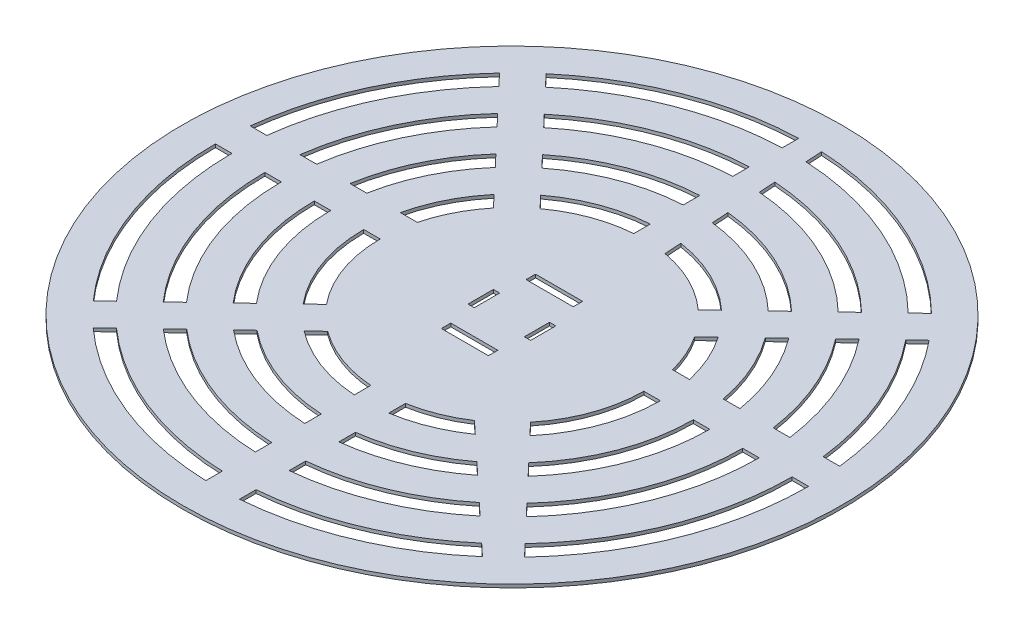
from build123d import *

# Parameters (mm, degrees)
SKETCH1_R           = 200
BOSS_EXTRUDE1_DEPTH = 2
SCALE1_SCALE        = 0.525
SKETCH2_W           = 15
SKETCH2_H           = 3
CUT_EXTRUDE2_DEPTH  = 10
SKETCH3_W           = 2
SKETCH3_H           = 8.084225929
CUT_EXTRUDE5_DEPTH  = 10


with BuildPart() as part:
    # Sketch1 → Boss-Extrude1 (new body)
    with BuildSketch(Plane(origin=(0, 0, 0), x_dir=(1, 0, 0), z_dir=(0, 1, 0))):
        Circle(SKETCH1_R)
        with BuildLine():
            Line((-5.909739139, -169.89724831), (-5.909739139, -179.902959907))
            ThreePointArc((-5.909739139, -179.902959907), (-67.235704511, -166.971135346), (-120.410158092, -133.796090482))
            Line((-120.410158092, -133.796090482), (-113.135735976, -126.886978234))
            ThreePointArc((-113.135735976, -126.886978234), (-63.288443806, -157.780140958), (-5.909739139, -169.89724831))
        make_face(mode=Mode.SUBTRACT)
        with BuildLine():
            Line((-5.909739139, -139.875212183), (-5.909739139, -149.883538066))
            ThreePointArc((-5.909739139, -149.883538066), (-55.39303126, -139.397317362), (-98.577379862, -113.059719527))
            Line((-98.577379862, -113.059719527), (-91.29207475, -106.140270811))
            ThreePointArc((-91.29207475, -106.140270811), (-51.444724931, -130.205377296), (-5.909739139, -139.875212183))
        make_face(mode=Mode.SUBTRACT)
        with BuildLine():
            Line((-5.909739139, -109.841135206), (-5.909739139, -119.854390755))
            ThreePointArc((-5.909739139, -119.854390755), (-43.546291593, -111.820036167), (-76.704044651, -92.284828299))
            Line((-76.704044651, -92.284828299), (-69.398107129, -85.345783299))
            ThreePointArc((-69.398107129, -85.345783299), (-39.595750955, -102.626392835), (-5.909739139, -109.841135206))
        make_face(mode=Mode.SUBTRACT)
        with BuildLine():
            Line((-127.258680478, -112.717470886), (-134.513606882, -119.608066466))
            ThreePointArc((-134.513606882, -119.608066466), (-168.244538156, -63.982617801), (-180, 0))
            Line((-180, 0), (-170, 0))
            ThreePointArc((-170, 0), (-158.955930498, -60.27447353), (-127.258680478, -112.717470886))
        make_face(mode=Mode.SUBTRACT)
        with BuildLine():
            Line((-150, 0), (-140, 0))
            ThreePointArc((-140, 0), (-131.088993889, -49.149523711), (-105.490347414, -92.042308764))
            Line((-105.490347414, -92.042308764), (-112.74716938, -98.934704714))
            ThreePointArc((-112.74716938, -98.934704714), (-140.378195257, -52.857944497), (-150, 0))
        make_face(mode=Mode.SUBTRACT)
        with BuildLine():
            Line((-120, 0), (-110, 0))
            ThreePointArc((-110, 0), (-103.219332532, -38.023274342), (-83.713283787, -71.358854514))
            Line((-83.713283787, -71.358854514), (-90.973680149, -78.254645359))
            ThreePointArc((-90.973680149, -78.254645359), (-112.509647626, -41.732232041), (-120, 0))
        make_face(mode=Mode.SUBTRACT)
        with BuildLine():
            Line((-5.909739139, -79.781420038), (-5.909739139, -89.805762528))
            ThreePointArc((-5.909739139, -89.805762528), (-31.690119633, -84.236193632), (-54.748873951, -71.432211229))
            Line((-54.748873951, -71.432211229), (-47.395994633, -64.448581774))
            ThreePointArc((-47.395994633, -64.448581774), (-27.733540985, -75.038994559), (-5.909739139, -79.781420038))
        make_face(mode=Mode.SUBTRACT)
        with BuildLine():
            Line((-90, 0), (-80, 0))
            ThreePointArc((-80, 0), (-75.343912949, -26.894140284), (-61.91763046, -50.657744109))
            Line((-61.91763046, -50.657744109), (-69.186065724, -57.561170155))
            ThreePointArc((-69.186065724, -57.561170155), (-84.636711642, -30.604363127), (-90, 0))
        make_face(mode=Mode.SUBTRACT)
        with BuildLine():
            ThreePointArc((118.005076915, -135.92204318), (69.540739921, -166.024352103), (14.090260861, -179.447665209))
            Line((14.090260861, -179.447665209), (14.090260861, -169.415065885))
            ThreePointArc((14.090260861, -169.415065885), (65.55584914, -156.851619831), (110.655154766, -129.055944163))
            Line((110.655154766, -129.055944163), (118.005076915, -135.92204318))
        make_face(mode=Mode.SUBTRACT)
        with BuildLine():
            ThreePointArc((14.090260861, -109.093833689), (41.637359325, -101.815177201), (66.390895605, -87.705467222))
            Line((66.390895605, -87.705467222), (73.797899912, -94.624890851))
            ThreePointArc((73.797899912, -94.624890851), (45.625612795, -110.987852746), (14.090260861, -119.16989783))
            Line((14.090260861, -119.16989783), (14.090260861, -109.093833689))
        make_face(mode=Mode.SUBTRACT)
        with BuildLine():
            ThreePointArc((14.090260861, -139.289140097), (53.599303159, -129.333347211), (88.568587752, -108.423269013))
            Line((88.568587752, -108.423269013), (95.93815533, -115.307720261))
            ThreePointArc((95.93815533, -115.307720261), (57.585213281, -138.506112542), (14.090260861, -149.336748822))
            Line((14.090260861, -149.336748822), (14.090260861, -139.289140097))
        make_face(mode=Mode.SUBTRACT)
        with BuildLine():
            ThreePointArc((14.090260861, -78.749378086), (29.660559415, -74.298393086), (44.015491221, -66.802967992))
            Line((44.015491221, -66.802967992), (51.508627774, -73.802854043))
            ThreePointArc((51.508627774, -73.802854043), (33.655763514, -83.470291615), (14.090260861, -88.890182522))
            Line((14.090260861, -88.890182522), (14.090260861, -78.749378086))
        make_face(mode=Mode.SUBTRACT)
        with BuildLine():
            Line((68.846964276, -57.966330831), (61.911971645, -50.664659942))
            ThreePointArc((61.911971645, -50.664659942), (75.342410804, -26.898348169), (80, 0))
            Line((80, 0), (90, 0))
            ThreePointArc((90, 0), (84.546516146, -30.852659652), (68.846964276, -57.966330831))
        make_face(mode=Mode.SUBTRACT)
        with BuildLine():
            Line((110.320906943, -101.633151537), (103.417789045, -94.365040714))
            ThreePointArc((103.417789045, -94.365040714), (130.534459945, -50.603900708), (140, 0))
            Line((140, 0), (150, 0))
            ThreePointArc((150, 0), (139.728551201, -54.552103344), (110.320906943, -101.633151537))
        make_face(mode=Mode.SUBTRACT)
        with BuildLine():
            Line((170, 0), (180, 0))
            ThreePointArc((180, 0), (167.307302442, -66.394778029), (131.01926056, -123.425902315))
            Line((131.01926056, -123.425902315), (124.121317963, -116.16324043))
            ThreePointArc((124.121317963, -116.16324043), (158.114869721, -62.44748172), (170, 0))
        make_face(mode=Mode.SUBTRACT)
        with BuildLine():
            Line((89.60328723, -79.820115995), (82.690389655, -72.541708408))
            ThreePointArc((82.690389655, -72.541708408), (102.946449337, -38.756013327), (110, 0))
            Line((110, 0), (120, 0))
            ThreePointArc((120, 0), (112.143645535, -42.706003866), (89.60328723, -79.820115995))
        make_face(mode=Mode.SUBTRACT)
        with BuildLine():
            ThreePointArc((-82.690389655, 72.541708408), (-98.978530572, 47.992191925), (-108.166538264, 20))
            Line((-108.166538264, 20), (-118.321595662, 20))
            ThreePointArc((-118.321595662, 20), (-108.179484196, 51.934566515), (-89.60328723, 79.820115995))
            Line((-89.60328723, 79.820115995), (-82.690389655, 72.541708408))
        make_face(mode=Mode.SUBTRACT)
        with BuildLine():
            ThreePointArc((-178.8854382, 20), (-163.353787516, 75.601191156), (-131.01926056, 123.425902315))
            Line((-131.01926056, 123.425902315), (-124.121317963, 116.16324043))
            ThreePointArc((-124.121317963, 116.16324043), (-154.160347302, 71.656034775), (-168.819430161, 20))
            Line((-168.819430161, 20), (-178.8854382, 20))
        make_face(mode=Mode.SUBTRACT)
        with BuildLine():
            ThreePointArc((-103.417789045, 94.365040714), (-126.575448623, 59.821867288), (-138.564064606, 20))
            Line((-138.564064606, 20), (-148.660687473, 20))
            ThreePointArc((-148.660687473, 20), (-135.771349772, 63.766296591), (-110.320906943, 101.633151537))
            Line((-110.320906943, 101.633151537), (-103.417789045, 94.365040714))
        make_face(mode=Mode.SUBTRACT)
        with BuildLine():
            ThreePointArc((-87.749643874, 20), (-80.566649367, 40.112529337), (-68.846964276, 57.966330831))
            Line((-68.846964276, 57.966330831), (-61.911971645, 50.664659942))
            ThreePointArc((-61.911971645, 50.664659942), (-71.352601576, 36.177427331), (-77.459666924, 20))
            Line((-77.459666924, 20), (-87.749643874, 20))
        make_face(mode=Mode.SUBTRACT)
        with BuildLine():
            Line((-47.41040155, 64.437984333), (-54.345394181, 71.739655222))
            ThreePointArc((-54.345394181, 71.739655222), (-31.452604521, 84.325166284), (-5.909739139, 89.805762528))
            Line((-5.909739139, 89.805762528), (-5.909739139, 79.781420038))
            ThreePointArc((-5.909739139, 79.781420038), (-27.741928656, 75.03589404), (-47.41040155, 64.437984333))
        make_face(mode=Mode.SUBTRACT)
        with BuildLine():
            Line((-5.909739139, 149.883538066), (-5.909739139, 139.875212183))
            ThreePointArc((-5.909739139, 139.875212183), (-49.997974434, 130.767742783), (-88.91621895, 108.138365105))
            Line((-88.91621895, 108.138365105), (-95.819336848, 115.406475928))
            ThreePointArc((-95.819336848, 115.406475928), (-53.706314142, 140.055816806), (-5.909739139, 149.883538066))
        make_face(mode=Mode.SUBTRACT)
        with BuildLine():
            Line((-5.909739139, 119.854390755), (-5.909739139, 109.841135206))
            ThreePointArc((-5.909739139, 109.841135206), (-38.871821078, 102.902777057), (-68.18881956, 86.315032799))
            Line((-68.18881956, 86.315032799), (-75.101717135, 93.593440386))
            ThreePointArc((-75.101717135, 93.593440386), (-42.580786635, 112.191250147), (-5.909739139, 119.854390755))
        make_face(mode=Mode.SUBTRACT)
        with BuildLine():
            Line((-109.619747868, 129.936564821), (-116.517690465, 137.199226706))
            ThreePointArc((-116.517690465, 137.199226706), (-64.830710988, 167.91956084), (-5.909739139, 179.902959907))
            Line((-5.909739139, 179.902959907), (-5.909739139, 169.89724831))
            ThreePointArc((-5.909739139, 169.89724831), (-61.122660677, 158.631712945), (-109.619747868, 129.936564821))
        make_face(mode=Mode.SUBTRACT)
        with BuildLine():
            ThreePointArc((77.459666924, 20), (73.123955807, 32.448221632), (66.802967992, 44.015491221))
            Line((66.802967992, 44.015491221), (74.15584731, 50.999120676))
            ThreePointArc((74.15584731, 50.999120676), (82.423196914, 36.1443856), (87.749643874, 20))
            Line((87.749643874, 20), (77.459666924, 20))
        make_face(mode=Mode.SUBTRACT)
        with BuildLine():
            ThreePointArc((53.777955037, 59.227793746), (35.310009149, 71.78581513), (14.090260861, 78.749378086))
            Line((14.090260861, 78.749378086), (13.477733677, 88.985115019))
            ThreePointArc((13.477733677, 88.985115019), (38.974817452, 81.123138528), (61.046390301, 66.131219792))
            Line((61.046390301, 66.131219792), (53.777955037, 59.227793746))
        make_face(mode=Mode.SUBTRACT)
        with BuildLine():
            Line((82.834004726, 86.824694996), (75.573608364, 79.928904151))
            ThreePointArc((75.573608364, 79.928904151), (46.310000146, 99.776670051), (12.26118123, 109.314516121))
            Line((12.26118123, 109.314516121), (11.655694936, 119.432595114))
            ThreePointArc((11.655694936, 119.432595114), (49.978941796, 109.096770699), (82.834004726, 86.824694996))
        make_face(mode=Mode.SUBTRACT)
        with BuildLine():
            ThreePointArc((108.166538264, 20), (101.013574043, 43.546042979), (88.805080488, 64.912692745))
            Line((88.805080488, 64.912692745), (96.11101801, 71.851737746))
            ThreePointArc((96.11101801, 71.851737746), (110.306333129, 47.249474829), (118.321595662, 20))
            Line((118.321595662, 20), (108.166538264, 20))
        make_face(mode=Mode.SUBTRACT)
        with BuildLine():
            ThreePointArc((138.564064606, 20), (128.889034539, 54.659096), (110.699048109, 85.707180257))
            Line((110.699048109, 85.707180257), (117.984353221, 92.626628974))
            ThreePointArc((117.984353221, 92.626628974), (138.179416849, 58.364790407), (148.660687473, 20))
            Line((148.660687473, 20), (138.564064606, 20))
        make_face(mode=Mode.SUBTRACT)
        with BuildLine():
            ThreePointArc((139.817131451, 113.362999929), (166.048168958, 69.483851257), (178.8854382, 20))
            Line((178.8854382, 20), (168.819430161, 20))
            ThreePointArc((168.819430161, 20), (156.758902312, 65.777249455), (132.542709335, 106.45388768))
            Line((132.542709335, 106.45388768), (139.817131451, 113.362999929))
        make_face(mode=Mode.SUBTRACT)
        with BuildLine():
            ThreePointArc((97.350671991, 100.612358401), (57.317958612, 127.728820634), (10.448263606, 139.609576275))
            Line((10.448263606, 139.609576275), (9.84583758, 149.676516135))
            ThreePointArc((9.84583758, 149.676516135), (60.987749983, 137.041943769), (104.607493957, 107.504754351))
            Line((104.607493957, 107.504754351), (97.350671991, 100.612358401))
        make_face(mode=Mode.SUBTRACT)
        with BuildLine():
            Line((126.373931459, 128.178116102), (119.119005055, 121.287520523))
            ThreePointArc((119.119005055, 121.287520523), (68.327544701, 155.664211157), (8.642795015, 169.780158129))
            Line((8.642795015, 169.780158129), (8.041974907, 179.820262039))
            ThreePointArc((8.041974907, 179.820262039), (71.997477596, 164.973825863), (126.373931459, 128.178116102))
        make_face(mode=Mode.SUBTRACT)
    extrude(amount=BOSS_EXTRUDE1_DEPTH)


with BuildPart() as part_1:
    # Scale1: scaled about (0.11240887, 1, 0.095880559)
    add(part.part.scale(SCALE1_SCALE).moved(Location((0.053394213, 0.475, 0.045543266))))

    # Sketch2 → Cut-Extrude2 (cut)
    with BuildSketch(Plane(origin=(0, 1.525, 0), x_dir=(1, 0, 0), z_dir=(0, 1, 0))):
        with Locations((0, 13.5)):
            Rectangle(SKETCH2_W, SKETCH2_H)
        with Locations((0, -13.5)):
            Rectangle(SKETCH2_W, SKETCH2_H)
    extrude(amount=-CUT_EXTRUDE2_DEPTH, mode=Mode.SUBTRACT)

    # Sketch3 → Cut-Extrude5 (cut)
    with BuildSketch(Plane(origin=(0, 1.525, 0), x_dir=(1, 0, 0), z_dir=(0, 1, 0))):
        with Locations((-9, 0.038626155)):
            Rectangle(SKETCH3_W, SKETCH3_H)
        Polygon((8.011061574, 3.943336722), (7.988694222, -4.053017186), (9.988694222, -4.053017186), (10.011061574, 3.943336722), align=None)
    extrude(amount=-CUT_EXTRUDE5_DEPTH, mode=Mode.SUBTRACT)


solid = part_1.part
